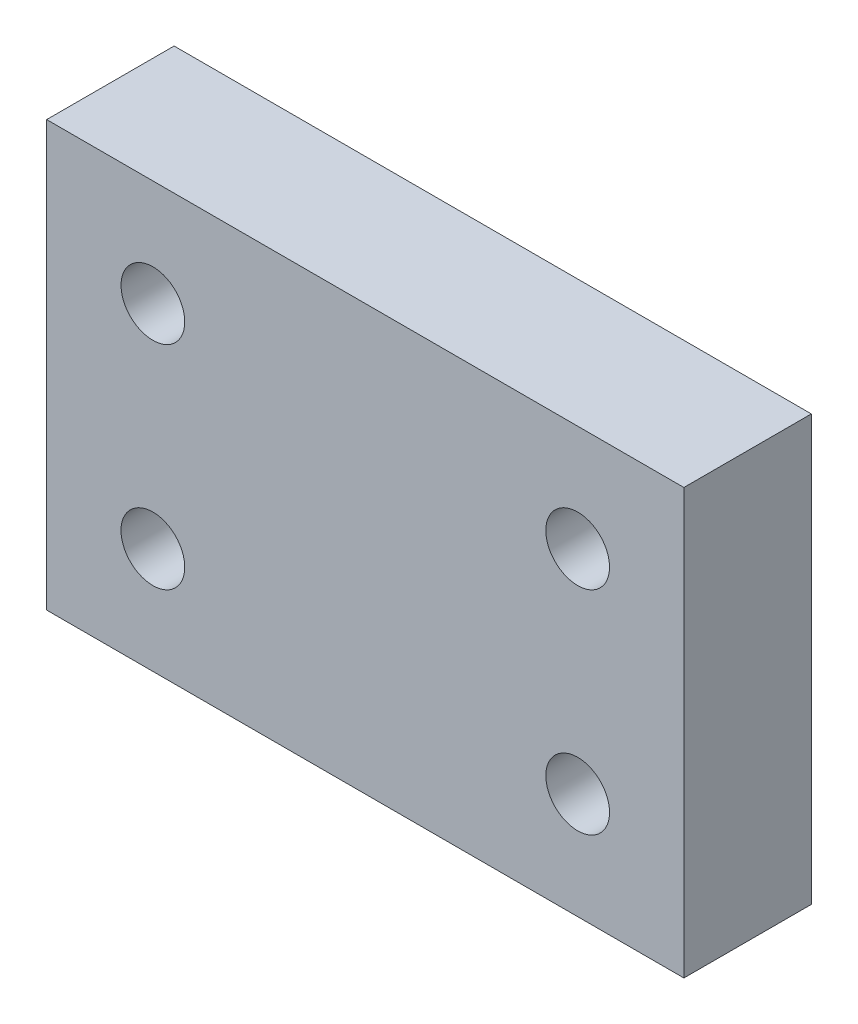
from build123d import *

# Parameters (mm, degrees)
ESQUISSE1_W        = 30
ESQUISSE1_H        = 20
ESQUISSE1_R        = 1.5
BOSS_EXTRU_1_DEPTH = 6


with BuildPart() as part:
    # Esquisse1 → Boss.-Extru.1 (new body)
    with BuildSketch(Plane.XY):
        with Locations((15, 10)):
            Rectangle(ESQUISSE1_W, ESQUISSE1_H)
        with Locations((5, 15)):
            Circle(ESQUISSE1_R, mode=Mode.SUBTRACT)
        with Locations(Location((25, 15, 0), (0, 0, 180))):
            Circle(ESQUISSE1_R, mode=Mode.SUBTRACT)
        with Locations((25, 5)):
            Circle(ESQUISSE1_R, mode=Mode.SUBTRACT)
        with Locations(Location((5, 5, 0), (0, 0, 180))):
            Circle(ESQUISSE1_R, mode=Mode.SUBTRACT)
    extrude(amount=BOSS_EXTRU_1_DEPTH)


solid = part.part
